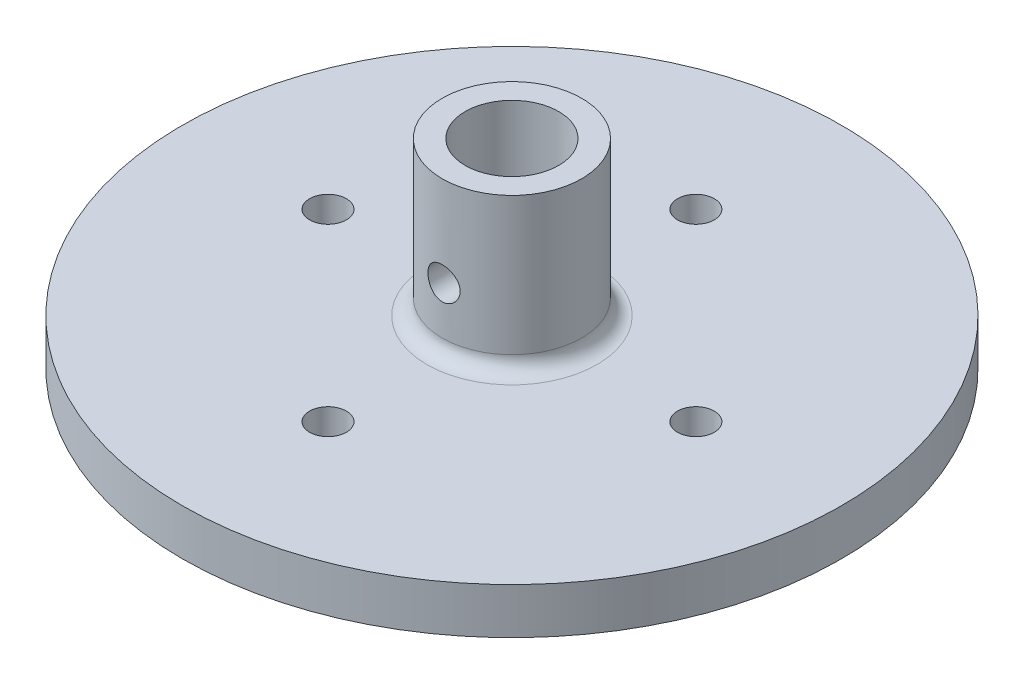
from build123d import *

# Parameters (mm, degrees)
SKETCH_1_R               = 21.5
EXTRUDE_1_DEPTH          = 3
SKETCH_2_R               = 4.55
SKETCH_2_R_2             = 3.05
EXTRUDE_2_DEPTH          = 10
SKETCH_3_R               = 1.05
CUT_EXTRUDE_1_DEPTH      = 8.5
CUT_EXTRUDE_2_REACH      = 34.008
SKETCH_4_R               = 1.2
PATTERN_CIRCULAR_1_COUNT = 4
FILLET_1_R               = 1


with BuildPart() as part:
    # 草图1 → 凸台-拉伸1 (new body)
    with BuildSketch(Plane(origin=(0, 0, 0), x_dir=(1, 0, 0), z_dir=(0, 1, 0))):
        with Locations(Location((0, 0, 0), (0, 0, 270))):
            Circle(SKETCH_1_R)
    extrude(amount=EXTRUDE_1_DEPTH)

    # 草图2 → 凸台-拉伸2 (add)
    with BuildSketch(Plane(origin=(0, 3, 0), x_dir=(1, 0, 0), z_dir=(0, 1, 0))):
        with Locations(Location((0, 0, 0), (0, 0, 270))):
            Circle(SKETCH_2_R)
        with Locations(Location((0, 0, 0), (0, 0, 270))):
            Circle(SKETCH_2_R_2, mode=Mode.SUBTRACT)
    extrude(amount=EXTRUDE_2_DEPTH)

    # 草图3 → 切除-拉伸1 (cut, symmetric)
    with BuildSketch(Plane.XY):
        with Locations((0, 7.1)):
            Circle(SKETCH_3_R)
    extrude(amount=CUT_EXTRUDE_1_DEPTH, both=True, mode=Mode.SUBTRACT)

    # 草图4 → 切除-拉伸2 (cut, up to next)
    with BuildSketch(Plane(origin=(0, 3, 0), x_dir=(1, 0, 0), z_dir=(0, 1, 0)), mode=Mode.PRIVATE) as cut_extrude_2_sk1:
        with Locations(Location((12, 0, 0), (0, 0, 270))):
            Circle(SKETCH_4_R)
    cut_extrude_2_tool1 = extrude(cut_extrude_2_sk1.sketch, amount=-CUT_EXTRUDE_2_REACH, mode=Mode.PRIVATE) & part.part
    cut_extrude_2 = cut_extrude_2_tool1.solids().sort_by_distance((12, 3, 0))[0]
    add(cut_extrude_2, mode=Mode.SUBTRACT)

    # 阵列(圆周)1: 切除-拉伸2 ×4 about axis
    pattern_circular_1_axis = Axis((0, 0, 0), (0, 1, 0))
    for i in range(1, PATTERN_CIRCULAR_1_COUNT):
        add(cut_extrude_2.rotate(pattern_circular_1_axis, i * 360 / PATTERN_CIRCULAR_1_COUNT), mode=Mode.SUBTRACT)

    # 圆角1
    fillet_1_edges = [part.edges().sort_by_distance(p)[0] for p in [
        (0, 3, -4.55),
    ]]
    fillet(fillet_1_edges, radius=FILLET_1_R)


solid = part.part
